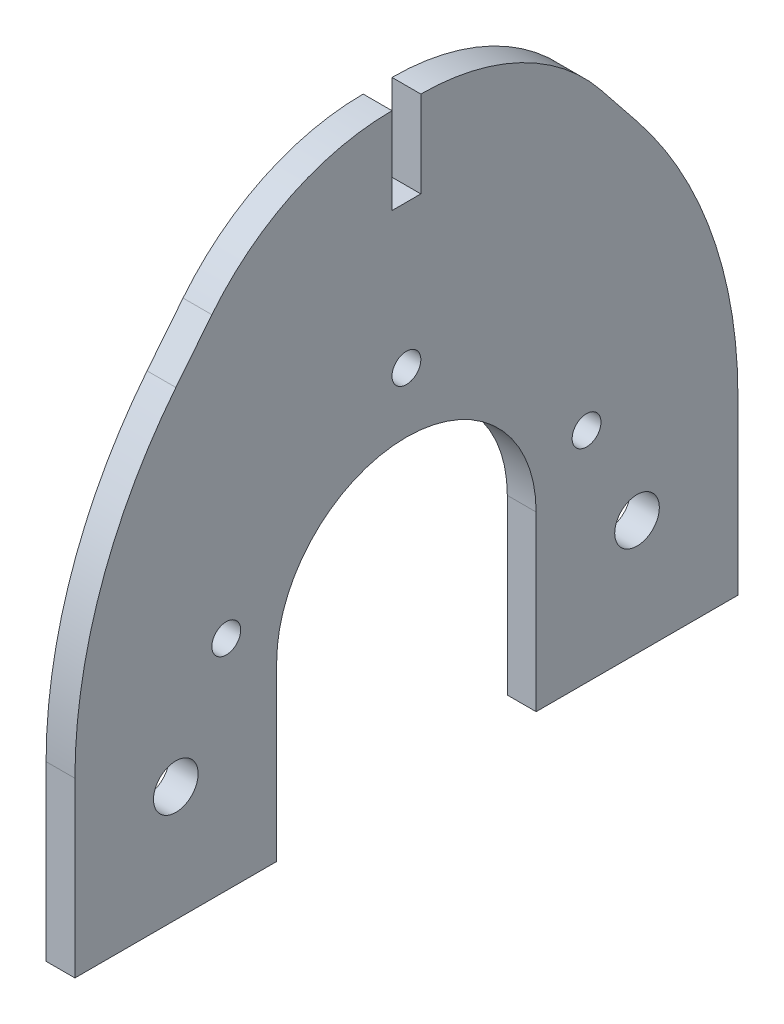
from build123d import *

# Parameters (mm, degrees)
BOSS_EXTRUDE1_DEPTH              = 3.175
F_10_0_1935_DIAMETER_HOLE1_D     = 4.9149
F_10_0_1935_DIAMETER_HOLE1_DEPTH = 19.001994
F_10_0_1935_DIAMETER_HOLE1_TIP   = 1.476584928
SKETCH4_R                        = 1.5875
CUT_EXTRUDE1_DEPTH               = 59.987451342


with BuildPart() as part:
    # Sketch1 → Boss-Extrude1 (new body)
    with BuildSketch(Plane(origin=(0, 0, 0), x_dir=(0, 0, -1), z_dir=(1, 0, 0))):
        with BuildLine():
            Line((1.5875, 46.219867315), (1.5875, 36.694867315))
            Line((1.5875, 36.694867315), (-1.5875, 36.694867315))
            Line((-1.5875, 36.694867315), (-1.5875, 46.219867315))
            ThreePointArc((-1.5875, 46.219867315), (-12.594751518, 43.710922642), (-21.42746878, 36.679742434))
            Line((-21.42746878, 36.679742434), (-25.39243756, 31.719750239))
            ThreePointArc((-25.39243756, 31.719750239), (-33.651945283, 16.80623652), (-36.5125, 0))
            Line((-36.5125, 0), (-36.5125, -19.05))
            Line((-36.5125, -19.05), (-14.2875, -19.05))
            Line((-14.2875, -19.05), (-14.2875, 0))
            ThreePointArc((-14.2875, 0), (0, 14.2875), (14.2875, 0))
            Line((14.2875, 0), (14.2875, -19.05))
            Line((14.2875, -19.05), (36.5125, -19.05))
            Line((36.5125, -19.05), (36.5125, 0))
            ThreePointArc((36.5125, 0), (33.651945283, 16.80623652), (25.39243756, 31.719750239))
            Line((25.39243756, 31.719750239), (21.42746878, 36.679742434))
            ThreePointArc((21.42746878, 36.679742434), (12.594751518, 43.710922642), (1.5875, 46.219867315))
        make_face()
    extrude(amount=BOSS_EXTRUDE1_DEPTH)

    # #10 (0.1935) Diameter Hole1
    with Locations(Plane.ZY):
        with Locations((-25.4, -6.35), (25.4, -6.35)):
            Hole(F_10_0_1935_DIAMETER_HOLE1_D / 2, depth=F_10_0_1935_DIAMETER_HOLE1_DEPTH)
            with Locations((0, 0, -(F_10_0_1935_DIAMETER_HOLE1_DEPTH + F_10_0_1935_DIAMETER_HOLE1_TIP / 2))):  # 118° drill point
                Cone(0, F_10_0_1935_DIAMETER_HOLE1_D / 2, F_10_0_1935_DIAMETER_HOLE1_TIP, mode=Mode.SUBTRACT)

    # Sketch4 → Cut-Extrude1 (cut, through all)
    with BuildSketch(Plane(origin=(3.175, 0, 0), x_dir=(0, 0, -1), z_dir=(1, 0, 0))):
        with Locations((-19.842621022, 5.0165)):
            Circle(SKETCH4_R)
        with Locations((0, 20.8915)):
            Circle(SKETCH4_R)
        with Locations((19.842621022, 5.0165)):
            Circle(SKETCH4_R)
    extrude(amount=-CUT_EXTRUDE1_DEPTH, mode=Mode.SUBTRACT)


solid = part.part
